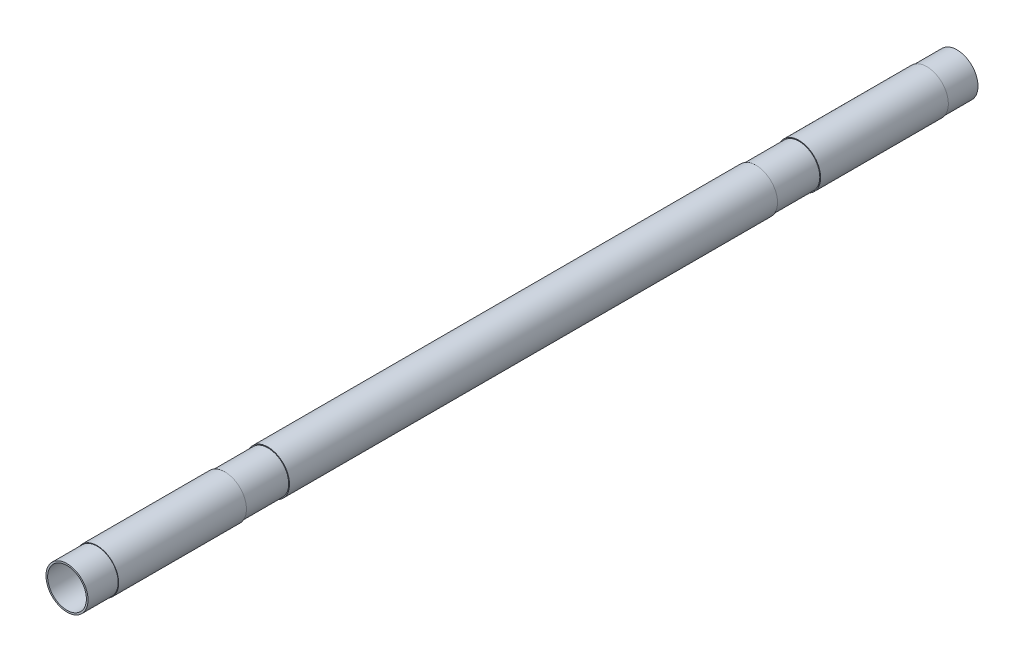
from build123d import *

# Parameters (mm, degrees)
SKETCH1_R           = 15
BOSS_EXTRUDE1_DEPTH = 620
SKETCH2_R           = 13.5
CUT_EXTRUDE1_DEPTH  = 621.362797079
SKETCH4_R           = 16.267367871
SKETCH4_R_2         = 14.447843326
CUT_EXTRUDE2_DEPTH  = 30
SKETCH5_R           = 16.193324777
SKETCH5_R_2         = 14.662495413
CUT_EXTRUDE3_DEPTH  = 21


with BuildPart() as part:
    # Sketch1 → Boss-Extrude1 (new body)
    with BuildSketch(Plane.XY):
        Circle(SKETCH1_R)
    extrude(amount=BOSS_EXTRUDE1_DEPTH)

    # Sketch2 → Cut-Extrude1 (cut, through all)
    with BuildSketch(Plane(origin=(0, 0, 0), x_dir=(-1, 0, 0), z_dir=(0, 0, -1))):
        Circle(SKETCH2_R)
    extrude(amount=-CUT_EXTRUDE1_DEPTH, mode=Mode.SUBTRACT)

    # Sketch4 → Cut-Extrude2 (cut)
    with BuildSketch(Plane.XY.offset(480)):
        Circle(SKETCH4_R)
        Circle(SKETCH4_R_2, mode=Mode.SUBTRACT)
    cut_extrude2 = extrude(amount=CUT_EXTRUDE2_DEPTH, mode=Mode.SUBTRACT)

    # Mirror1: Cut-Extrude2 across plane
    add(cut_extrude2.mirror(Plane.XY.offset(310)), mode=Mode.SUBTRACT)

    # Sketch5 → Cut-Extrude3 (cut)
    with BuildSketch(Plane.XY.offset(620)):
        Circle(SKETCH5_R)
        Circle(SKETCH5_R_2, mode=Mode.SUBTRACT)
    cut_extrude3 = extrude(amount=-CUT_EXTRUDE3_DEPTH, mode=Mode.SUBTRACT)

    # Mirror2: Cut-Extrude3 across plane
    add(cut_extrude3.mirror(Plane.XY.offset(310)), mode=Mode.SUBTRACT)


solid = part.part
